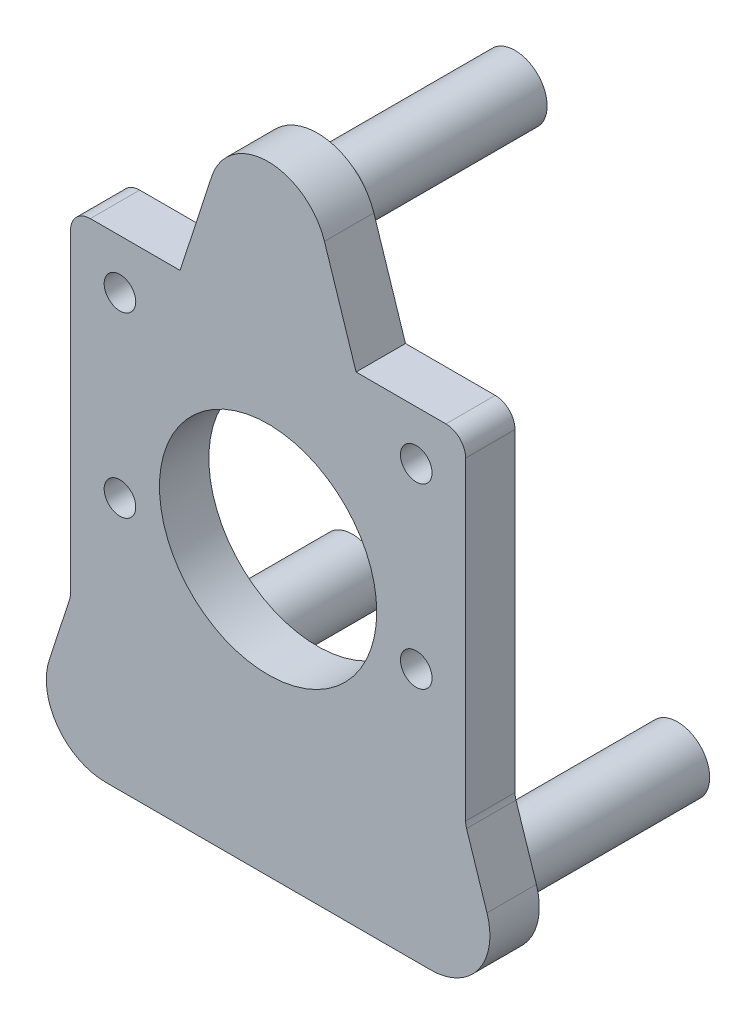
from build123d import *

# Parameters (mm, degrees)
SKETCH_1_R          = 11
EXTRUDE_1_DEPTH     = 5
SKETCH_2_R          = 3.25
EXTRUDE_2_DEPTH     = 20
FILLET_1_R          = 2
EXTRUDE_3_DEPTH     = 5
FILLET_2_R          = 2
SKETCH_4_R          = 1.6
CUT_EXTRUDE_1_DEPTH = 5


with BuildPart() as part:
    # 草图1 → 凸台-拉伸1 (new body)
    with BuildSketch(Plane.XY):
        with BuildLine():
            Line((-5.706339098, 29.854101966), (-22.164326162, -20.798373876))
            ThreePointArc((-22.164326162, -20.798373876), (-21.31208903, -26.179187356), (-16.457987064, -28.652475842))
            Line((-16.457987064, -28.652475842), (16.457987064, -28.652475842))
            ThreePointArc((16.457987064, -28.652475842), (21.31208903, -26.179187356), (22.164326162, -20.798373876))
            Line((22.164326162, -20.798373876), (5.706339098, 29.854101966))
            ThreePointArc((5.706339098, 29.854101966), (0, 34), (-5.706339098, 29.854101966))
        make_face()
        Circle(SKETCH_1_R, mode=Mode.SUBTRACT)
    extrude(amount=EXTRUDE_1_DEPTH)

    # 草图2 → 凸台-拉伸2 (add)
    with BuildSketch(Plane(origin=(0, 0, 0), x_dir=(-1, 0, 0), z_dir=(0, 0, -1))):
        with Locations(Location((0, 28, 0), (0, 0, 180))):
            Circle(SKETCH_2_R)
        with Locations(Location((-16.457987064, -22.652475842, 0), (0, 0, 180))):
            Circle(SKETCH_2_R)
        with Locations(Location((16.457987064, -22.652475842, 0), (0, 0, 180))):
            Circle(SKETCH_2_R)
    extrude(amount=EXTRUDE_2_DEPTH)

    # 圆角1
    fillet_1_edges = [part.edges().sort_by_distance(p)[0] for p in [
        (-3.25, 28, 0),
        (13.207987064, -22.652475842, 0),
        (-19.707987064, -22.652475842, 0),
    ]]
    fillet(fillet_1_edges, radius=FILLET_1_R)

    # 草图3 → 凸台-拉伸3 (add)
    with BuildSketch(Plane.XY.offset(5)):
        Polygon((-20, 20), (-8.908130915, 20), (-20, -14.137262879), align=None)
        Polygon((20, 20), (20, -14.137262879), (8.908130915, 20), align=None)
    extrude(amount=-EXTRUDE_3_DEPTH)

    # 圆角2
    fillet_2_edges = [part.edges().sort_by_distance(p)[0] for p in [
        (-20, -14.137262879, 2.5),
        (-20, 20, 2.5),
        (20, 20, 2.5),
        (20, -14.137262879, 2.5),
    ]]
    fillet(fillet_2_edges, radius=FILLET_2_R)

    # 草图4 → 切除-拉伸1 (cut)
    with BuildSketch(Plane.XY.offset(5)):
        with Locations((-15, 15)):
            Circle(SKETCH_4_R)
        with Locations((15, 15)):
            Circle(SKETCH_4_R)
        with Locations((15, -3)):
            Circle(SKETCH_4_R)
        with Locations((-15, -3)):
            Circle(SKETCH_4_R)
    extrude(amount=-CUT_EXTRUDE_1_DEPTH, mode=Mode.SUBTRACT)


solid = part.part
